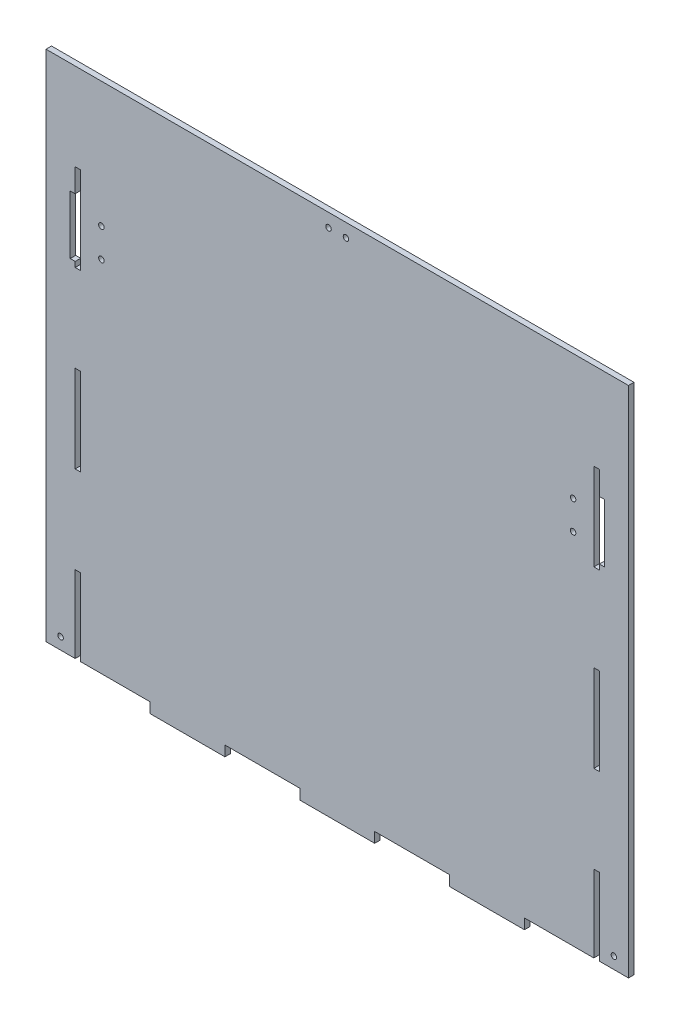
from build123d import *

# Parameters (mm, degrees)
SKETCH1_W           = 279.4
SKETCH1_H           = 279.4
SKETCH1_W_2         = 2.9972
SKETCH1_H_2         = 47.498
SKETCH1_W_3         = 40.770628572
SKETCH1_H_3         = 5.588
BOSS_EXTRUDE1_DEPTH = 1.4986
SKETCH3_R           = 1.5
CUT_EXTRUDE2_DEPTH  = 204.666583022
SKETCH4_R           = 1.5
BOSS_EXTRUDE2_DEPTH = 2.9972
SKETCH5_R           = 1.5
CUT_EXTRUDE3_DEPTH  = 216.087723417


with BuildPart() as part:
    # Sketch1 → Boss-Extrude1 (new, symmetric)
    with BuildSketch(Plane.XY):
        Rectangle(SKETCH1_W, SKETCH1_H)
        with Locations((-141.1986, -74.041)):
            Rectangle(SKETCH1_W_2, SKETCH1_H_2)
        with Locations((-81.541257143, -142.494)):
            Rectangle(SKETCH1_W_3, SKETCH1_H_3)
        with Locations((0, -142.494)):
            Rectangle(SKETCH1_W_3, SKETCH1_H_3)
        with Locations((81.541257143, -142.494)):
            Rectangle(SKETCH1_W_3, SKETCH1_H_3)
        with Locations((141.1986, -74.041)):
            Rectangle(SKETCH1_W_2, SKETCH1_H_2)
        with Locations((141.1986, 20.955)):
            Rectangle(SKETCH1_W_2, SKETCH1_H_2)
        with Locations((141.1986, 115.951)):
            Rectangle(SKETCH1_W_2, SKETCH1_H_2)
        with Locations((-141.1986, 20.955)):
            Rectangle(SKETCH1_W_2, SKETCH1_H_2)
        with Locations((-141.1986, 115.951)):
            Rectangle(SKETCH1_W_2, SKETCH1_H_2)
    extrude(amount=BOSS_EXTRUDE1_DEPTH, both=True)

    # Sketch3 → Cut-Extrude2 (cut, through all)
    with BuildSketch(Plane.XY.offset(1.4986)):
        with Locations((-128.4097, 71.374)):
            Circle(SKETCH3_R)
        with Locations((-128.4097, 55.626)):
            Circle(SKETCH3_R)
        with Locations((128.4097, 71.374)):
            Circle(SKETCH3_R)
        with Locations((128.4097, 55.626)):
            Circle(SKETCH3_R)
    extrude(amount=-CUT_EXTRUDE2_DEPTH, mode=Mode.SUBTRACT)

    # Sketch4 → Boss-Extrude2 (add)
    # profile 1 of 2: a face of its own
    with BuildSketch(Plane.XY.offset(1.4986)):
        Polygon((-142.6972, 79.4385), (-142.6972, 139.7), (-158.5722, 139.7), (-158.5722, -139.7), (-142.6972, -139.7), (-142.6972, 47.5615), (-145.3972, 47.5615), (-145.3972, 79.4385), align=None)
        with Locations((-150.6347, -133.35)):
            Circle(SKETCH4_R, mode=Mode.SUBTRACT)
    # profile 2 of 2: a face of its own
    with BuildSketch(Plane.XY.offset(1.4986)):
        Polygon((158.5722, 139.7), (142.6972, 139.7), (142.6972, 79.4385), (145.3972, 79.4385), (145.3972, 47.5615), (142.6972, 47.5615), (142.6972, -139.7), (158.5722, -139.7), align=None)
        with Locations((150.6347, -133.35)):
            Circle(SKETCH4_R, mode=Mode.SUBTRACT)
    extrude(amount=-BOSS_EXTRUDE2_DEPTH)

    # Sketch5 → Cut-Extrude3 (cut, through all)
    with BuildSketch(Plane.XY.offset(1.4986)):
        with Locations((-4.7625, 132.3975)):
            Circle(SKETCH5_R)
        with Locations((4.7625, 132.3975)):
            Circle(SKETCH5_R)
    extrude(amount=-CUT_EXTRUDE3_DEPTH, mode=Mode.SUBTRACT)


solid = part.part
